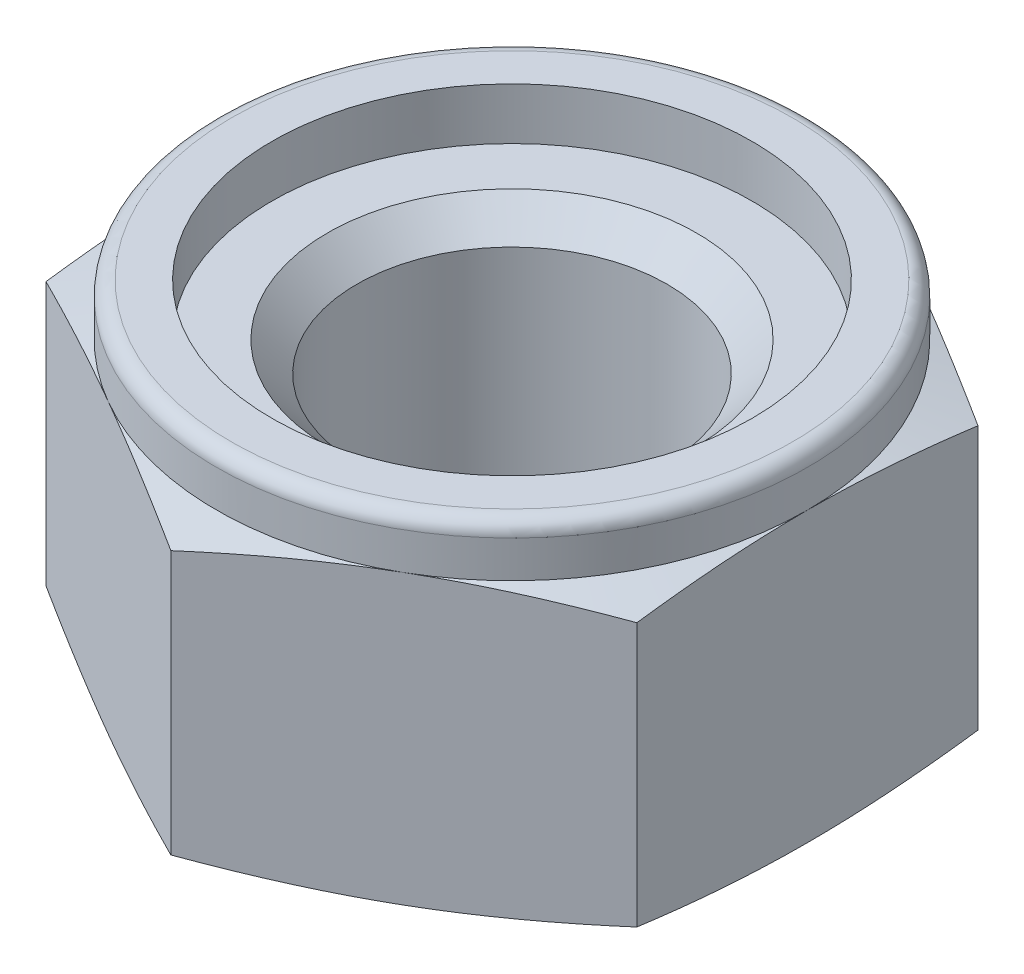
from build123d import *

# Parameters (mm, degrees)
BOSS_EXTRUDE1_DEPTH = 3.9
TAPPED_HOLE1_D      = 4.2
CHAMFER1_SIZE       = 0.4
SKETCH5_W           = 0.75
SKETCH5_H           = 0.7
FILLET1_R           = 0.2


with BuildPart() as part:
    # Sketch1 → Boss-Extrude1 (new body)
    with BuildSketch(Plane(origin=(0, 0, 0), x_dir=(1, 0, 0), z_dir=(0, 1, 0))):
        Polygon((0, 4.618802154), (-4, 2.309401077), (-4, -2.309401077), (0, -4.618802154), (4, -2.309401077), (4, 2.309401077), align=None)
    extrude(amount=-BOSS_EXTRUDE1_DEPTH)

    # Sketch2 → Cut-Revolve1 (revolve, cut)
    with BuildSketch(Plane(origin=(0, 0, 0), x_dir=(0, 0, -1), z_dir=(1, 0, 0))):
        Polygon((4, 0), (4.618802154, 0), (4.618802154, -0.165807537), align=None)
        Polygon((4.618802154, -3.734192463), (4, -3.9), (4.618802154, -3.9), align=None)
    revolve(axis=Axis((0, 0, 0), (0, -1, 0)), mode=Mode.SUBTRACT)

    # Tapped Hole1 (through all)
    with Locations(Plane(origin=(0, 0, 0), x_dir=(1, 0, 0), z_dir=(0, 1, 0))):
        with Locations((0, 0)):
            Hole(TAPPED_HOLE1_D / 2)

    # Chamfer1
    chamfer1_edges = [part.edges().sort_by_distance(p)[0] for p in [
        (2.1, 0, 0),
        (2.1, -3.9, 0),
    ]]
    chamfer(chamfer1_edges, length=CHAMFER1_SIZE)

    # Sketch5 → Revolve1 (revolve)
    with BuildSketch(Plane.XY, mode=Mode.PRIVATE) as revolve1_sk:
        with Locations((3.625, 0.35)):
            Rectangle(SKETCH5_W, SKETCH5_H)
    revolve(revolve1_sk.sketch.rotate(Axis((0, 0, 0), (0, 1, 0)), 270), axis=Axis((0, 0, 0), (0, 1, 0)))

    # Fillet1
    fillet1_edges = [part.edges().sort_by_distance(p)[0] for p in [
        (0, 0.7, -4),
    ]]
    fillet(fillet1_edges, radius=FILLET1_R)


solid = part.part
